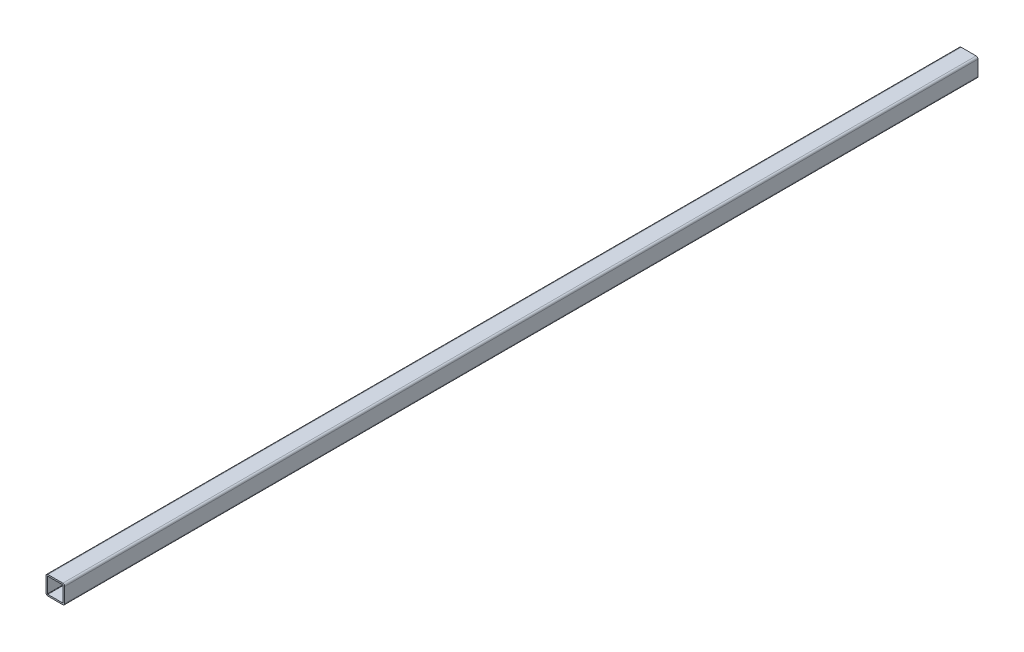
from build123d import *

# Parameters (mm, degrees)
EXTRUDE_THIN1_DEPTH = 609.6


with BuildPart() as part:
    # Sketch1 → Extrude-Thin1 (new, symmetric)
    with BuildSketch(Plane.XY):
        with BuildLine():
            Line((-12.5, -10), (-12.5, 10))
            ThreePointArc((-12.5, 10), (-11.767766953, 11.767766953), (-10, 12.5))
            Line((-10, 12.5), (10, 12.5))
            ThreePointArc((10, 12.5), (11.767766953, 11.767766953), (12.5, 10))
            Line((12.5, 10), (12.5, -10))
            ThreePointArc((12.5, -10), (11.767766953, -11.767766953), (10, -12.5))
            Line((10, -12.5), (-10, -12.5))
            ThreePointArc((-10, -12.5), (-11.767766953, -11.767766953), (-12.5, -10))
        make_face()
        with BuildLine():
            Line((-10.5, -10), (-10.5, 10))
            ThreePointArc((-10.5, 10), (-10.353553391, 10.353553391), (-10, 10.5))
            Line((-10, 10.5), (10, 10.5))
            ThreePointArc((10, 10.5), (10.353553391, 10.353553391), (10.5, 10))
            Line((10.5, 10), (10.5, -10))
            ThreePointArc((10.5, -10), (10.353553391, -10.353553391), (10, -10.5))
            Line((10, -10.5), (-10, -10.5))
            ThreePointArc((-10, -10.5), (-10.353553391, -10.353553391), (-10.5, -10))
        make_face(mode=Mode.SUBTRACT)
    extrude(amount=EXTRUDE_THIN1_DEPTH, both=True)


solid = part.part
